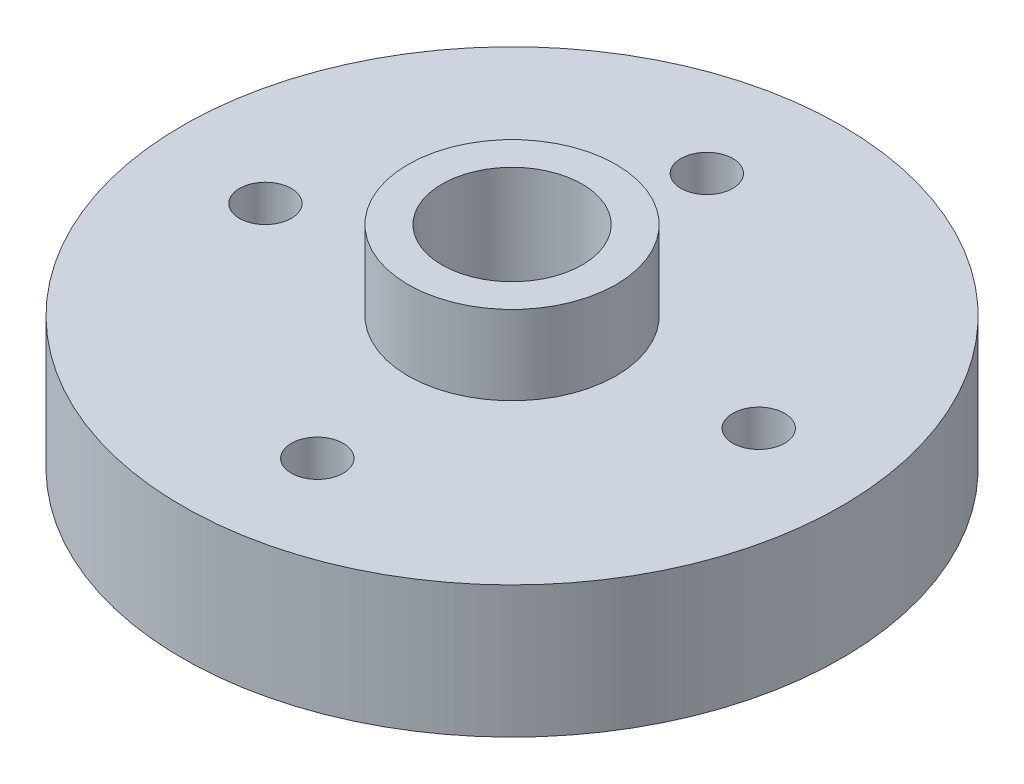
from build123d import *

# Parameters (mm, degrees)
SKETCH1_R           = 9.525
BOSS_EXTRUDE1_DEPTH = 3.81
SKETCH2_R           = 3.006995321
BOSS_EXTRUDE2_DEPTH = 2.286
SKETCH3_R           = 0.749981853
CUT_EXTRUDE1_DEPTH  = 12.446
SKETCH4_R           = 2.02646881
CUT_EXTRUDE2_DEPTH  = 12.446


with BuildPart() as part:
    # Sketch1 → Boss-Extrude1 (new body)
    with BuildSketch(Plane(origin=(0, 0, 0), x_dir=(1, 0, 0), z_dir=(0, 1, 0))):
        with Locations(Location((0, 0, 0), (0, 0, 90))):
            Circle(SKETCH1_R)
    extrude(amount=BOSS_EXTRUDE1_DEPTH)

    # Sketch2 → Boss-Extrude2 (add)
    with BuildSketch(Plane(origin=(0, 3.81, 0), x_dir=(1, 0, 0), z_dir=(0, 1, 0))):
        with Locations(Location((0, 0, 0), (0, 0, 270))):
            Circle(SKETCH2_R)
    extrude(amount=BOSS_EXTRUDE2_DEPTH)

    # Sketch3 → Cut-Extrude1 (cut)
    with BuildSketch(Plane(origin=(0, 3.81, 0), x_dir=(1, 0, 0), z_dir=(0, 1, 0))):
        with Locations(Location((-0.749981853, 6.378803081, 0), (0, 0, 270))):
            Circle(SKETCH3_R)
        with Locations(Location((6.378803081, 0.749981853, 0), (0, 0, 270))):
            Circle(SKETCH3_R)
        with Locations(Location((0.749981853, -6.378803081, 0), (0, 0, 270))):
            Circle(SKETCH3_R)
        with Locations(Location((-6.378803081, -0.749981853, 0), (0, 0, 270))):
            Circle(SKETCH3_R)
    extrude(amount=-CUT_EXTRUDE1_DEPTH, mode=Mode.SUBTRACT)

    # Sketch4 → Cut-Extrude2 (cut)
    with BuildSketch(Plane(origin=(0, 6.096, 0), x_dir=(1, 0, 0), z_dir=(0, 1, 0))):
        with Locations(Location((0, 0, 0), (0, 0, 270))):
            Circle(SKETCH4_R)
    extrude(amount=-CUT_EXTRUDE2_DEPTH, mode=Mode.SUBTRACT)


solid = part.part
